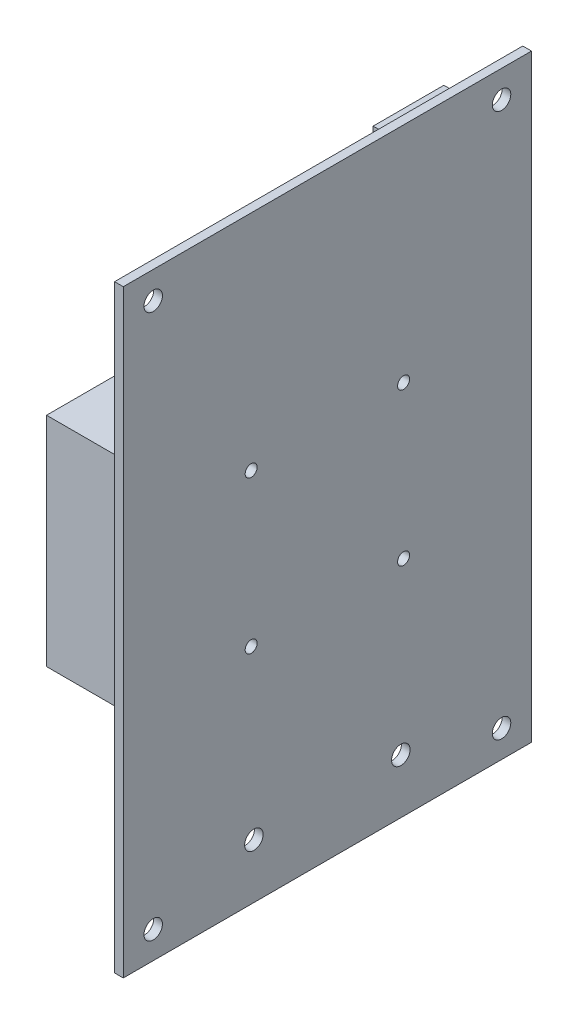
from build123d import *

# Parameters (mm, degrees)
BOARD_START                         = -30
BOARD_SKETCH_W                      = 75
BOARD_SKETCH_H                      = 110
BOARD_SKETCH_R                      = 1.7
BOARD_SKETCH_R_2                    = 1.1
BOARD_DEPTH                         = 1.6
TEENSY_START                        = -31.6
TEENSY_4_1_SKETCH_W                 = 18
TEENSY_4_1_SKETCH_H                 = 61
TEENSY_4_1_DEPTH                    = 5
BAROMETER_START                     = -31.6
BAROMETER_BMP388_BOARD_EST_SKETCH_W = 13
BAROMETER_BMP388_BOARD_EST_SKETCH_H = 18
BAROMETER_BMP388_BOARD_EST_DEPTH    = 3
VENT_START                          = -31.6
VENT_BACKUP_SKETCH_W                = 15
VENT_BACKUP_SKETCH_H                = 40
VENT_BACKUP_DEPTH                   = 15


with BuildPart() as part:
    # Board Sketch → Board (new body)
    with BuildSketch(Plane(origin=(0, 0, 0), x_dir=(0, 0, -1), z_dir=(1, 0, 0)).offset(BOARD_START)):
        Rectangle(BOARD_SKETCH_W, BOARD_SKETCH_H)
        with Locations((32, -50)):
            Circle(BOARD_SKETCH_R, mode=Mode.SUBTRACT)
        with Locations((-32, -50)):
            Circle(BOARD_SKETCH_R, mode=Mode.SUBTRACT)
        with Locations((32, 50)):
            Circle(BOARD_SKETCH_R, mode=Mode.SUBTRACT)
        with Locations((-32, 50)):
            Circle(BOARD_SKETCH_R, mode=Mode.SUBTRACT)
        with Locations((13.5, -45)):
            Circle(BOARD_SKETCH_R, mode=Mode.SUBTRACT)
        with Locations((-13.5, -45)):
            Circle(BOARD_SKETCH_R, mode=Mode.SUBTRACT)
        with Locations((14, -14)):
            Circle(BOARD_SKETCH_R_2, mode=Mode.SUBTRACT)
        with Locations((-14, -14)):
            Circle(BOARD_SKETCH_R_2, mode=Mode.SUBTRACT)
        with Locations((14, 14)):
            Circle(BOARD_SKETCH_R_2, mode=Mode.SUBTRACT)
        with Locations((-14, 14)):
            Circle(BOARD_SKETCH_R_2, mode=Mode.SUBTRACT)
    extrude(amount=-BOARD_DEPTH)

    # Teensy 4.1 Sketch → Teensy 4.1 (add)
    with BuildSketch(Plane(origin=(0, 0, 0), x_dir=(0, 0, -1), z_dir=(1, 0, 0)).offset(TEENSY_START)):
        with Locations((28, 0)):
            Rectangle(TEENSY_4_1_SKETCH_W, TEENSY_4_1_SKETCH_H)
    extrude(amount=-TEENSY_4_1_DEPTH)

    # Barometer BMP388 board [est] Sketch → Barometer BMP388 board [est] (add)
    with BuildSketch(Plane(origin=(0, 0, 0), x_dir=(0, 0, -1), z_dir=(1, 0, 0)).offset(BAROMETER_START)):
        with Locations((19.5, 44)):
            Rectangle(BAROMETER_BMP388_BOARD_EST_SKETCH_W, BAROMETER_BMP388_BOARD_EST_SKETCH_H)
    extrude(amount=-BAROMETER_BMP388_BOARD_EST_DEPTH)

    # Vent backup Sketch → Vent backup (add)
    with BuildSketch(Plane(origin=(0, 0, 0), x_dir=(0, 0, -1), z_dir=(1, 0, 0)).offset(VENT_START)):
        with Locations((-27.5, 5)):
            Rectangle(VENT_BACKUP_SKETCH_W, VENT_BACKUP_SKETCH_H)
    extrude(amount=-VENT_BACKUP_DEPTH)


solid = part.part
